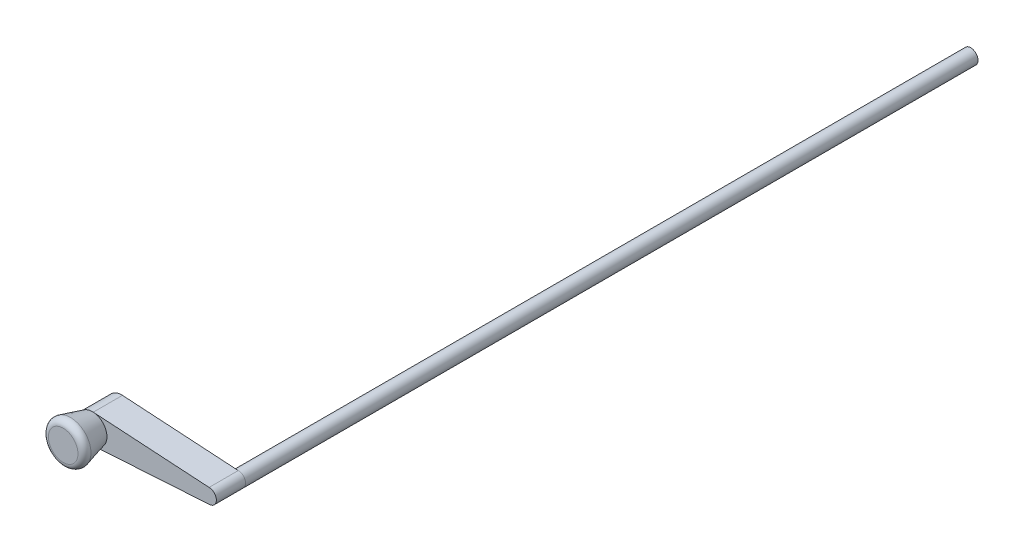
from build123d import *

# Parameters (mm, degrees)
BOSS_EXTRUDE1_DEPTH      = 38.1
BOSS_EXTRUDE1_DEPTH_BACK = 312.42
SKETCH1_R                = 3.175
BOSS_EXTRUDE2_DEPTH      = 12.7
SKETCH6_R                = 6.35
BOSS_EXTRUDE3_DEPTH      = 12.7
BOSS_EXTRUDE3_DRAFT      = -15
SKETCH7_R                = 26.162
CUT_EXTRUDE1_DEPTH       = 31.75
FILLET1_R                = 2.54


with BuildPart() as part:
    # Sketch1 → Boss-Extrude1 (new, two sides: drawn at the far end of the back side and taken through both)
    with BuildSketch(Plane.XY.offset(-BOSS_EXTRUDE1_DEPTH_BACK)):
        Circle(SKETCH1_R)
    extrude(amount=BOSS_EXTRUDE1_DEPTH + BOSS_EXTRUDE1_DEPTH_BACK)

    # Sketch5 → Boss-Extrude2 (add)
    with BuildSketch(Plane.XY.offset(38.1)):
        with BuildLine():
            Line((0, -3.181219399), (-50.403125, -6.337585521))
            ThreePointArc((-50.403125, -6.337585521), (-57.15, 0), (-50.403125, 6.337585521))
            Line((-50.403125, 6.337585521), (0, 3.181219399))
            ThreePointArc((0, 3.181219399), (3.181219399, 0), (0, -3.181219399))
        make_face()
    extrude(amount=BOSS_EXTRUDE2_DEPTH)


with BuildPart() as boss_extrude3_tool:
    # Sketch6 → Boss-Extrude3 (with draft: the straight prism first)
    with BuildSketch(Plane.XY.offset(50.8)):
        with Locations((-50.8, 0)):
            Circle(SKETCH6_R)
    extrude(amount=BOSS_EXTRUDE3_DEPTH)
    # Boss-Extrude3: the draft: its side faces are tilted about the plane it starts from
    boss_extrude3_sides = [boss_extrude3_tool.faces().sort_by_distance(p)[0] for p in [
        (-57.15, 0, 57.15),
    ]]
    draft(boss_extrude3_sides, Plane.XY.offset(50.8), BOSS_EXTRUDE3_DRAFT)


with BuildPart() as part_1:
    add(part.part)

    # Boss-Extrude3: add boss_extrude3_tool
    add(boss_extrude3_tool.part)

    # Sketch7 → Cut-Extrude1 (cut)
    with BuildSketch(Plane(origin=(0, 0, -312.42), x_dir=(-1, 0, 0), z_dir=(0, 0, -1))):
        Circle(SKETCH7_R)
    extrude(amount=-CUT_EXTRUDE1_DEPTH, mode=Mode.SUBTRACT)

    # Fillet1
    fillet1_edges = [part_1.edges().sort_by_distance(p)[0] for p in [
        (-60.552954744, 0, 63.5),
    ]]
    fillet(fillet1_edges, radius=FILLET1_R)


solid = part_1.part
